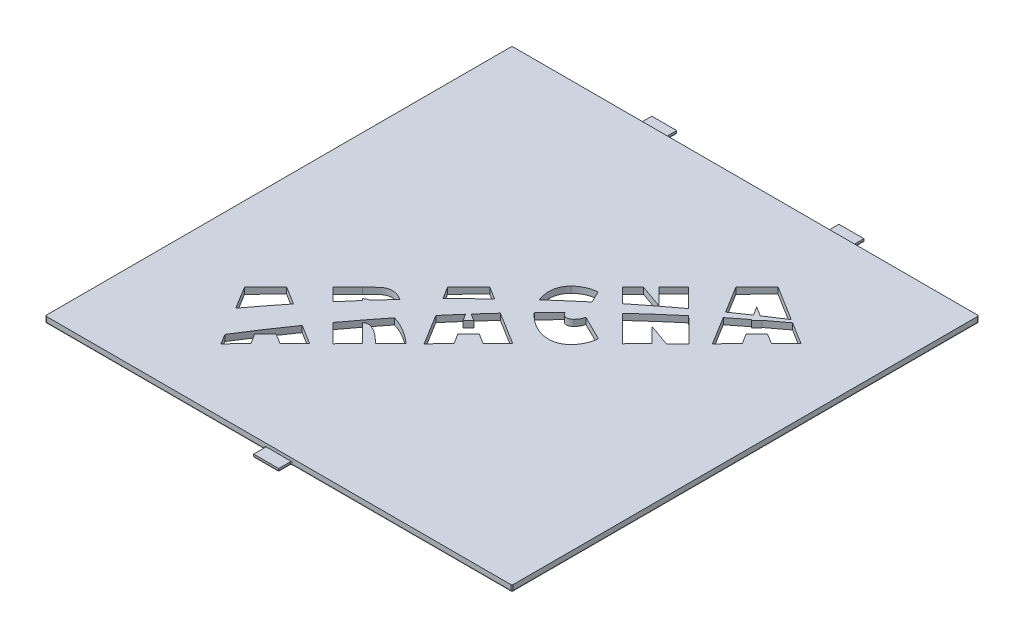
from build123d import *

# Parameters (mm, degrees)
SKETCH1_W           = 74.8
SKETCH1_H           = 74.8
BOSS_EXTRUDE1_DEPTH = 1
SKETCH3_W           = 4
SKETCH3_H           = 2
BOSS_EXTRUDE2_DEPTH = 0.5
FILLET1_R           = 0.2
CUT_EXTRUDE2_DEPTH  = 55.333415133
BOSS_EXTRUDE3_DEPTH = 1


with BuildPart() as part:
    # Sketch1 → Boss-Extrude1 (new body)
    with BuildSketch(Plane(origin=(0, 0, 0), x_dir=(1, 0, 0), z_dir=(0, 1, 0))):
        Rectangle(SKETCH1_W, SKETCH1_H)
    extrude(amount=BOSS_EXTRUDE1_DEPTH)

    # Sketch3 → Boss-Extrude2 (add)
    with BuildSketch(Plane(origin=(0, 0, 0), x_dir=(1, 0, 0), z_dir=(0, 1, 0))):
        with Locations((0, -38.4)):
            Rectangle(SKETCH3_W, SKETCH3_H)
        with Locations((-15, 38.4)):
            Rectangle(SKETCH3_W, SKETCH3_H)
        with Locations((15, 38.4)):
            Rectangle(SKETCH3_W, SKETCH3_H)
    extrude(amount=BOSS_EXTRUDE2_DEPTH)

    # Fillet1
    fillet1_edges = [part.edges().sort_by_distance(p)[0] for p in [
        (19.7, 0, 37.4),
        (2, 0, 38.4),
        (2, 0.25, 37.4),
        (-2, 0, 38.4),
        (-2, 0.25, 37.4),
        (0, 0, 39.4),
        (-27.2, 0, -37.4),
        (-13, 0, -38.4),
        (-13, 0.25, -37.4),
        (-15, 0, -39.4),
        (-17, 0, -38.4),
        (-17, 0.25, -37.4),
        (0, 0, -37.4),
        (17, 0, -38.4),
        (17, 0.25, -37.4),
        (15, 0, -39.4),
        (13, 0, -38.4),
        (13, 0.25, -37.4),
        (-19.7, 0, 37.4),
        (-37.4, 0, 0),
        (27.2, 0, -37.4),
        (37.4, 0, 0),
        (37.4, 0.5, 37.4),
        (-37.4, 0.5, 37.4),
        (-37.4, 0.5, -37.4),
        (37.4, 0.5, -37.4),
    ]]
    fillet(fillet1_edges, radius=FILLET1_R)

    # Sketch4 → Cut-Extrude2 (cut, through all)
    # profile 1 of 6: a face of its own
    with BuildSketch(Plane(origin=(0, 0, 0), x_dir=(1, 0, 0), z_dir=(0, 1, 0))):
        Polygon((-18.08180305, -23.159391706), (-17.039810863, -24.800797956), (-19.426724925, -27.204899518), (-25.4122718, -17.453141706), (-22.049967113, -14.067204206), (-12.354068675, -20.082829206), (-14.71305305, -22.459001081), (-16.367349925, -21.434196393), align=None)
        Polygon((-19.510513988, -20.899235456), (-18.638248363, -20.020524518), (-20.999381175, -18.540251081), align=None, mode=Mode.SUBTRACT)
    # profile 2 of 6: a face of its own
    with BuildSketch(Plane(origin=(0, 0, 0), x_dir=(1, 0, 0), z_dir=(0, 1, 0))):
        with BuildLine():
            Line((-10.447928681, -18.221806399), (-18.336991181, -10.386454837))
            Line((-18.336991181, -10.386454837), (-15.978006806, -8.012431399))
            add(Edge.make_bspline(
                [(-15.978006806, -8.012431399), (-15.880120108, -7.914094217), (-15.692557073, -7.725667998), (-15.419953335, -7.458943548), (-15.168697553, -7.221835204), (-14.943223866, -7.009575753), (-14.739063357, -6.826927619), (-14.557876542, -6.671878502), (-14.397644249, -6.547259558), (-14.220047608, -6.414353252), (-14.00157819, -6.288751443), (-13.731665153, -6.177350014), (-13.447692798, -6.108308318), (-13.151326962, -6.078120312), (-12.842872441, -6.089921886), (-12.523214875, -6.142631236), (-12.193946544, -6.239377166), (-11.857427992, -6.374121772), (-11.523162053, -6.544793242), (-11.200302607, -6.747308645), (-10.892066682, -6.979838868), (-10.704129966, -7.157644183), (-10.609061494, -7.247587649)],
                knots=[0, 0, 0, 0, 1.306104603, 2.502658145, 3.589865974, 4.558102546, 5.41745056, 6.168400154, 6.802223932, 7.328087018, 8.255399091, 9.165496919, 10.068023211, 10.996388338, 11.960980535, 12.965069309, 14.038288778, 15.184960568, 16.372823154, 17.566163088, 18.768834727, 20, 20, 20, 20], degree=3))
            add(Edge.make_bspline(
                [(-10.609061494, -7.247587649), (-10.514486553, -7.345070281), (-10.331639155, -7.53353929), (-10.088701972, -7.830909409), (-9.882587139, -8.127970613), (-9.711952737, -8.426127105), (-9.58305747, -8.725712931), (-9.488681878, -9.02557874), (-9.430884766, -9.326485432), (-9.422816711, -9.528273642), (-9.418827119, -9.628056399)],
                knots=[0, 0, 0, 0, 1.192743187, 2.306001844, 3.368768449, 4.366038332, 5.318506614, 6.227863048, 7.123691565, 8, 8, 8, 8], degree=3))
            add(Edge.make_bspline(
                [(-9.418827119, -9.628056399), (-9.22372696, -9.679937653), (-8.827046526, -9.78542336), (-8.240521489, -10.008349619), (-7.645560185, -10.271094019), (-7.048681088, -10.590451032), (-6.44287939, -10.953496118), (-5.834522004, -11.370036732), (-5.217028364, -11.831849362), (-4.815901149, -12.170418426), (-4.610623994, -12.343681399)],
                knots=[0, 0, 0, 0, 0.869006857, 1.766877178, 2.698933794, 3.668947317, 4.680395597, 5.739554508, 6.843215316, 8, 8, 8, 8], degree=3))
            Line((-4.610623994, -12.343681399), (-7.057694306, -14.807939212))
            Line((-7.057694306, -14.807939212), (-7.130741181, -14.734892337))
            add(Edge.make_bspline(
                [(-7.130741181, -14.734892337), (-7.243924826, -14.623886872), (-7.463150639, -14.408879982), (-7.792887179, -14.108211779), (-8.108502242, -13.833975236), (-8.412569677, -13.589854578), (-8.703571554, -13.37310367), (-8.98295788, -13.185531627), (-9.25019567, -13.026353335), (-9.504914229, -12.896314269), (-9.744325032, -12.794207582), (-9.968858801, -12.722919012), (-10.176533382, -12.676341657), (-10.370125926, -12.665699573), (-10.548045007, -12.681693872), (-10.711588938, -12.726596159), (-10.858406167, -12.804780907), (-10.939849987, -12.878268986), (-10.980741181, -12.915165774)],
                knots=[0, 0, 0, 0, 1.657290759, 3.210012509, 4.664477941, 6.027871459, 7.285727498, 8.456903256, 9.544493949, 10.535623868, 11.445022162, 12.261940535, 12.996135144, 13.663538282, 14.280395826, 14.856319258, 15.425782434, 16, 16, 16, 16], degree=3))
            Line((-10.980741181, -12.915165774), (-11.010819306, -12.945243899))
            Line((-11.010819306, -12.945243899), (-8.088944306, -15.847782962))
            Line((-8.088944306, -15.847782962), (-10.447928681, -18.221806399))
        make_face()
        with BuildLine():
            Line((-14.315116181, -9.585087649), (-14.353788056, -9.625907962))
            Line((-14.353788056, -9.625907962), (-12.834842744, -11.134111087))
            Line((-12.834842744, -11.134111087), (-12.774686494, -11.071806399))
            add(Edge.make_bspline(
                [(-12.774686494, -11.071806399), (-12.722923915, -11.016330797), (-12.625700156, -10.912133001), (-12.523000479, -10.736986101), (-12.461135682, -10.563008178), (-12.456110834, -10.384949492), (-12.497201148, -10.204126067), (-12.590296585, -10.020884597), (-12.726634738, -9.829293154), (-12.841697336, -9.708222677), (-12.903592744, -9.643095462)],
                knots=[0, 0, 0, 0, 1.096235369, 2.059018806, 2.922019498, 3.742356431, 4.603358566, 5.582608615, 6.69961717, 8, 8, 8, 8], degree=3))
            add(Edge.make_bspline(
                [(-12.903592744, -9.643095462), (-12.963744844, -9.587688419), (-13.076824327, -9.483529131), (-13.259336176, -9.360946886), (-13.442258566, -9.286028264), (-13.624369019, -9.252668386), (-13.805788699, -9.268730497), (-13.982973374, -9.331896171), (-14.156402734, -9.438779181), (-14.260137759, -9.534406319), (-14.315116181, -9.585087649)],
                knots=[0, 0, 0, 0, 1.212326034, 2.279042673, 3.241810863, 4.125603358, 4.999958362, 5.910486062, 6.8925806, 8, 8, 8, 8], degree=3))
        make_face(mode=Mode.SUBTRACT)
    # profile 3 of 6: a face of its own
    with BuildSketch(Plane(origin=(0, 0, 0), x_dir=(1, 0, 0), z_dir=(0, 1, 0))):
        Polygon((-1.805972714, -6.88356137), (-0.763980527, -8.52496762), (-3.150894589, -10.929069182), (-9.136441464, -1.17731137), (-5.774136777, 2.20862613), (3.921761661, -3.80699887), (1.562777286, -6.183170745), (-0.091519589, -5.158366057), align=None)
        Polygon((-3.234683652, -4.62340512), (-2.362418027, -3.744694182), (-4.723550839, -2.264420745), align=None, mode=Mode.SUBTRACT)
    # profile 4 of 6: a face of its own
    with BuildSketch(Plane(origin=(0, 0, 0), x_dir=(1, 0, 0), z_dir=(0, 1, 0))):
        with BuildLine():
            Line((6.130831342, 5.711055187), (10.105440717, 3.736641124))
            add(Edge.make_bspline(
                [(10.105440717, 3.736641124), (10.099412921, 3.631048183), (10.086636339, 3.407232248), (10.011410704, 3.058576248), (9.904093635, 2.677950366), (9.757649389, 2.273263585), (9.571557197, 1.858386763), (9.32647858, 1.458620587), (9.041845025, 1.070304788), (8.818333939, 0.833980594), (8.704659467, 0.713789562)],
                knots=[0, 0, 0, 0, 0.744902328, 1.578902988, 2.507835861, 3.533510484, 4.611506884, 5.708072289, 6.834359056, 8, 8, 8, 8], degree=3))
            add(Edge.make_bspline(
                [(8.704659467, 0.713789562), (8.597997998, 0.613821029), (8.38817196, 0.417161434), (8.039055586, 0.169674235), (7.665504924, -0.025121941), (7.270395386, -0.171004198), (6.853880471, -0.272150028), (6.414884009, -0.316754738), (5.954810419, -0.316781509), (5.47791698, -0.265819294), (4.993774241, -0.170208572), (4.511664197, -0.026589975), (4.036201108, 0.1603081), (3.567824075, 0.394926997), (3.105238749, 0.672818024), (2.648581796, 0.996731336), (2.199150168, 1.366671189), (1.913172711, 1.640030524), (1.76735478, 1.779414562)],
                knots=[0, 0, 0, 0, 0.897523436, 1.765621543, 2.619857071, 3.478941208, 4.347741683, 5.2462678, 6.183568056, 7.170078604, 8.188423965, 9.211805436, 10.256951964, 11.323582851, 12.426916965, 13.56971844, 14.760816204, 16, 16, 16, 16], degree=3))
            add(Edge.make_bspline(
                [(1.76735478, 1.779414562), (1.624341142, 1.926587207), (1.344162872, 2.214913396), (0.964706604, 2.669349165), (0.633474702, 3.13301534), (0.343351953, 3.600987388), (0.101383566, 4.078335344), (-0.094947624, 4.562735526), (-0.246049688, 5.054408557), (-0.351700878, 5.548186414), (-0.407804982, 6.035368784), (-0.415217473, 6.505421876), (-0.374661556, 6.954632717), (-0.275421428, 7.380193021), (-0.132850942, 7.785936035), (0.066453431, 8.166362541), (0.311426666, 8.528010772), (0.511779352, 8.742844026), (0.613643842, 8.852070812)],
                knots=[0, 0, 0, 0, 1.235283866, 2.42004681, 3.560382018, 4.663751456, 5.732062566, 6.778579793, 7.806978871, 8.825185185, 9.814665235, 10.754743967, 11.651459412, 12.5227792, 13.379292575, 14.233621615, 15.101927519, 16, 16, 16, 16], degree=3))
            add(Edge.make_bspline(
                [(0.613643842, 8.852070812), (0.710583847, 8.944523418), (0.90650362, 9.131373974), (1.240163797, 9.374576542), (1.601302838, 9.600316497), (1.993151737, 9.793459756), (2.397007929, 9.959211001), (2.805304837, 10.079107348), (3.209403696, 10.161158137), (3.479290107, 10.176506054), (3.612862592, 10.184102062)],
                knots=[0, 0, 0, 0, 0.957645518, 1.935441348, 2.948005545, 4.002247978, 5.05761082, 6.067799032, 7.043712933, 8, 8, 8, 8], degree=3))
            Line((3.612862592, 10.184102062), (5.413253217, 6.424336437))
            add(Edge.make_bspline(
                [(5.413253217, 6.424336437), (5.308866683, 6.388631271), (5.096356144, 6.315942547), (4.794658844, 6.147983568), (4.501937592, 5.9355415), (4.322184451, 5.766185742), (4.229464155, 5.678828624)],
                knots=[0, 0, 0, 0, 0.935428654, 1.904349537, 2.919021206, 4, 4, 4, 4], degree=3))
            add(Edge.make_bspline(
                [(4.229464155, 5.678828624), (4.171834488, 5.618020231), (4.063452076, 5.503659682), (3.937004389, 5.319859079), (3.85202565, 5.141428528), (3.808507531, 4.966737538), (3.806494902, 4.794711837), (3.855272744, 4.629160218), (3.943925083, 4.470255194), (4.028243148, 4.378113372), (4.072628217, 4.329609874)],
                knots=[0, 0, 0, 0, 1.296172441, 2.43767322, 3.440224515, 4.34156006, 5.206813512, 6.070786056, 6.984460878, 8, 8, 8, 8], degree=3))
            add(Edge.make_bspline(
                [(4.072628217, 4.329609874), (4.120409045, 4.287297635), (4.212917478, 4.205376932), (4.376153876, 4.121325821), (4.551453516, 4.079885694), (4.735645153, 4.078153491), (4.923488646, 4.118022577), (5.109731966, 4.198043414), (5.292565285, 4.31851563), (5.402662305, 4.422963947), (5.460518842, 4.477852062)],
                knots=[0, 0, 0, 0, 0.972446096, 1.882752327, 2.771896584, 3.702111816, 4.674311599, 5.68444737, 6.783165461, 8, 8, 8, 8], degree=3))
            add(Edge.make_bspline(
                [(5.460518842, 4.477852062), (5.546532252, 4.570743075), (5.713927251, 4.751522923), (5.910612288, 5.056207966), (6.055869693, 5.375531166), (6.10592862, 5.599592036), (6.130831342, 5.711055187)],
                knots=[0, 0, 0, 0, 1.064259065, 2.071207807, 3.040487286, 4, 4, 4, 4], degree=3))
        make_face()
    # profile 5 of 6: a face of its own
    with BuildSketch(Plane(origin=(0, 0, 0), x_dir=(1, 0, 0), z_dir=(0, 1, 0))):
        Polygon((12.716102042, 9.726794637), (15.109461417, 7.350622762), (12.750477042, 4.976599324), (4.861414542, 12.811950887), (6.54793798, 14.509216512), (10.436609855, 13.151404012), (7.800477042, 15.770349324), (10.155164542, 18.142224324), (18.095789542, 10.255310262), (16.306141105, 8.452771199), align=None)
    # profile 6 of 6: a face of its own
    with BuildSketch(Plane(origin=(0, 0, 0), x_dir=(1, 0, 0), z_dir=(0, 1, 0))):
        Polygon((21.295205827, 16.217617172), (22.337198015, 14.576210922), (19.950283952, 12.172109359), (13.964737077, 21.923867172), (17.327041765, 25.309804672), (27.022940202, 19.294179672), (24.663955827, 16.918007797), (23.009658952, 17.942812484), align=None)
        Polygon((19.86649489, 18.477773422), (20.738760515, 19.356484359), (18.377627702, 20.836757797), align=None, mode=Mode.SUBTRACT)
    extrude(amount=CUT_EXTRUDE2_DEPTH, mode=Mode.SUBTRACT)


with BuildPart() as cut_extrude2_piece_1:
    # of the separate pieces the step leaves, piece 1, a body of its own (cut_extrude2_pieces)
    add(part.part.solids().sort_by_distance((-37.2, 1, -37.4))[0])



with BuildPart() as cut_extrude2_piece_2:
    # of the separate pieces the step leaves, piece 2, a body of its own (cut_extrude2_pieces)
    add(part.part.solids().sort_by_distance((-14.315116181, 1, 9.585087649))[0])


with BuildPart() as cut_extrude2_piece_3:
    # of the separate pieces the step leaves, piece 3, a body of its own (cut_extrude2_pieces)
    add(part.part.solids().sort_by_distance((19.86649489, 1, -18.477773422))[0])


with BuildPart() as cut_extrude2_piece_4:
    # of the separate pieces the step leaves, piece 4, a body of its own (cut_extrude2_pieces)
    add(part.part.solids().sort_by_distance((-3.234683652, 1, 4.62340512))[0])


with BuildPart() as cut_extrude2_piece_5:
    # of the separate pieces the step leaves, piece 5, a body of its own (cut_extrude2_pieces)
    add(part.part.solids().sort_by_distance((-19.510513988, 1, 20.899235456))[0])


with BuildPart() as cut_extrude2_piece_1_1:
    add(cut_extrude2_piece_1.part)

    add(cut_extrude2_piece_2.part)  # Boss-Extrude3 merges Cut-Extrude2 piece 2

    add(cut_extrude2_piece_3.part)  # Boss-Extrude3 merges Cut-Extrude2 piece 3

    add(cut_extrude2_piece_4.part)  # Boss-Extrude3 merges Cut-Extrude2 piece 4

    add(cut_extrude2_piece_5.part)  # Boss-Extrude3 merges Cut-Extrude2 piece 5
    # Sketch5 → Boss-Extrude3 (add)
    with BuildSketch(Plane(origin=(0, 0, 0), x_dir=(1, 0, 0), z_dir=(0, 1, 0))):
        with BuildLine():
            Line((-24.469397763, -22.826589049), (-24.469397763, -32.363719355))
            add(Edge.make_bspline(
                [(30.706979881, 26.561537597), (-4.12545566, 3.4431013), (-24.469397763, -32.363719355)],
                knots=[0, 0, 0, 1, 1, 1], degree=2))
            add(Edge.make_bspline(
                [(-24.469397763, -22.826589049), (-2.248229739, 7.728077368), (30.706979881, 26.561537597)],
                knots=[0, 0, 0, 1, 1, 1], degree=2))
        make_face()
    extrude(amount=BOSS_EXTRUDE3_DEPTH)


solid = cut_extrude2_piece_1_1.part
